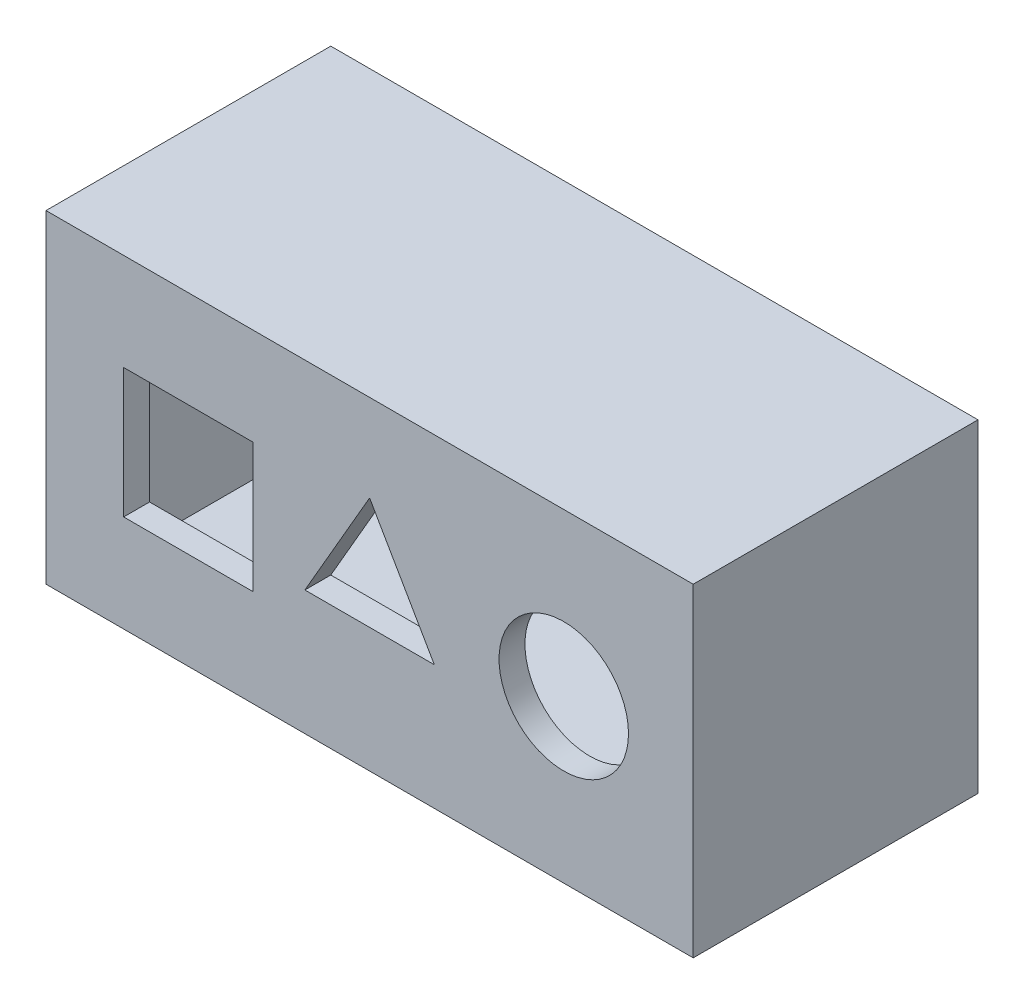
from build123d import *

# Parameters (mm, degrees)
SKETCH1_W           = 250
SKETCH1_H           = 125
SKETCH1_W_2         = 230
SKETCH1_H_2         = 115
BOSS_EXTRUDE1_DEPTH = 100
SKETCH3_W           = 250
SKETCH3_H           = 125
SKETCH3_W_2         = 230
SKETCH3_H_2         = 115
SKETCH3_R           = 25
SKETCH3_W_3         = 50
SKETCH3_H_3         = 50
BOSS_EXTRUDE4_DEPTH = 10


with BuildPart() as part:
    # Sketch1 → Boss-Extrude1 (new body)
    with BuildSketch(Plane.XY):
        Rectangle(SKETCH1_W, SKETCH1_H)
        Rectangle(SKETCH1_W_2, SKETCH1_H_2, mode=Mode.SUBTRACT)
    extrude(amount=BOSS_EXTRUDE1_DEPTH)

    # Sketch3 → Boss-Extrude4 (add)
    # profile 1 of 2: a face of its own
    with BuildSketch(Plane.XY.offset(100)):
        Rectangle(SKETCH3_W, SKETCH3_H)
        Rectangle(SKETCH3_W_2, SKETCH3_H_2, mode=Mode.SUBTRACT)
    # profile 2 of 2: a face of its own
    with BuildSketch(Plane.XY.offset(100)):
        Rectangle(SKETCH3_W_2, SKETCH3_H_2)
        with Locations((75, 0)):
            Circle(SKETCH3_R, mode=Mode.SUBTRACT)
        with Locations((-70, 0)):
            Rectangle(SKETCH3_W_3, SKETCH3_H_3, mode=Mode.SUBTRACT)
        Polygon((0, 28.867513459), (25, -14.43375673), (-25, -14.43375673), align=None, mode=Mode.SUBTRACT)
    extrude(amount=BOSS_EXTRUDE4_DEPTH)


solid = part.part
